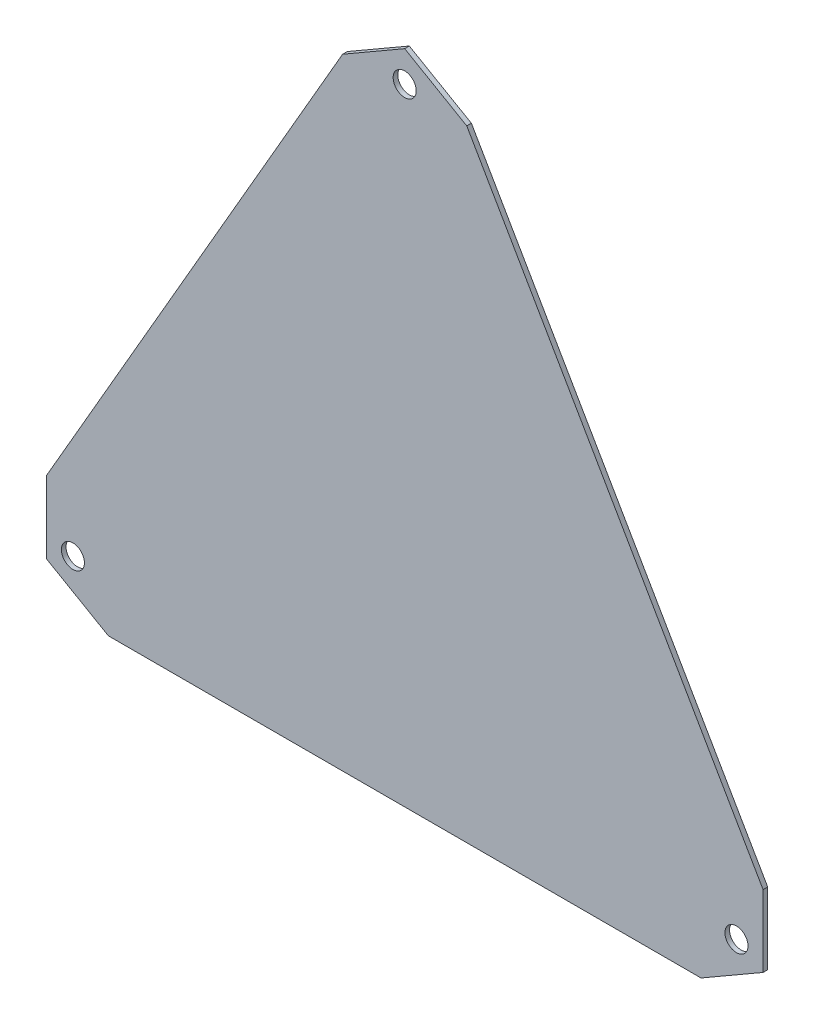
from build123d import *

# Parameters (mm, degrees)
ESQUISSE1_R        = 3
BOSS_EXTRU_1_DEPTH = 1.2


with BuildPart() as part:
    # Esquisse1 → Boss.-Extru.1 (new body)
    with BuildSketch(Plane.XY):
        Polygon((-77.032527304, -63.106708073), (-93.168275992, -53.790729224), (-93.168275992, -35.158771527), (-16.135748688, 98.265479599), (0, 107.581458448), (16.135748688, 98.265479599), (93.168275992, -35.158771527), (93.168275992, -53.790729224), (77.032527304, -63.106708073), align=None)
        with Locations((-86.240072762, -49.790729224)):
            Circle(ESQUISSE1_R, mode=Mode.SUBTRACT)
        with Locations((0, 99.581458448)):
            Circle(ESQUISSE1_R, mode=Mode.SUBTRACT)
        with Locations((86.240072762, -49.790729224)):
            Circle(ESQUISSE1_R, mode=Mode.SUBTRACT)
    extrude(amount=BOSS_EXTRU_1_DEPTH)


solid = part.part
